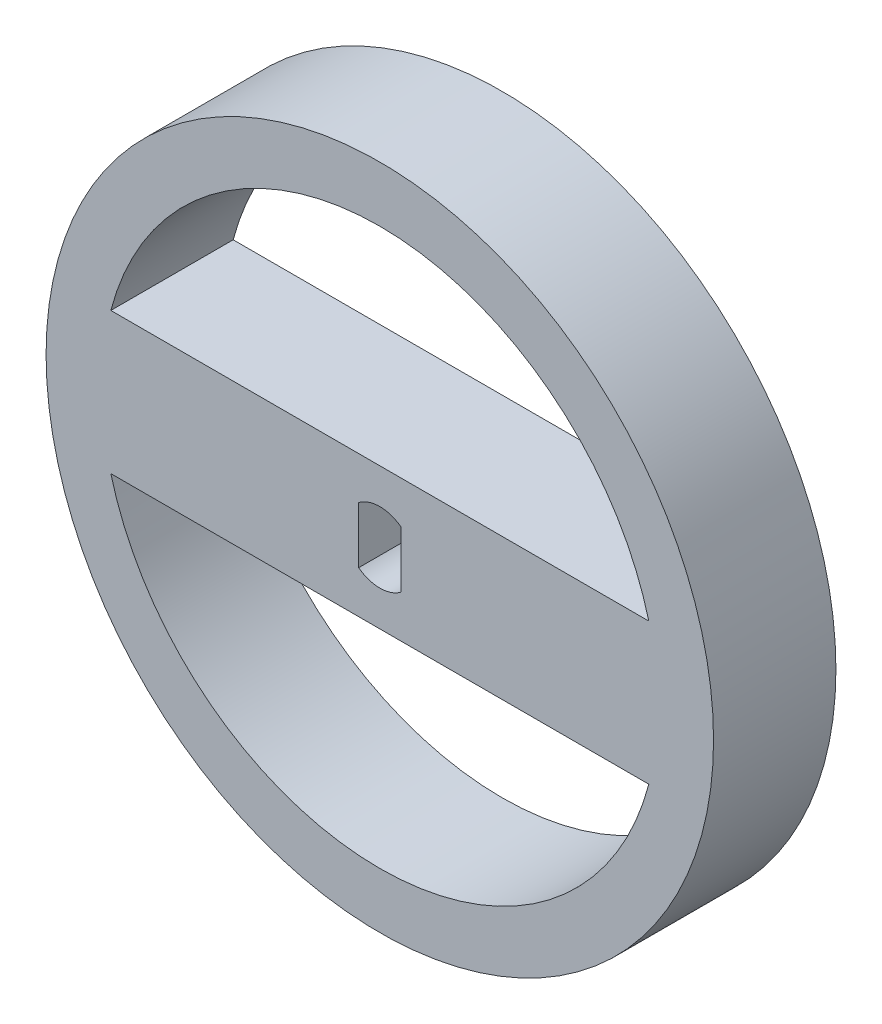
from build123d import *

# Parameters (mm, degrees)
SKETCH2_R           = 30
BOSS_EXTRUDE1_DEPTH = 11
CUT_EXTRUDE1_DEPTH  = 10


with BuildPart() as part:
    # Sketch2 → Boss-Extrude1 (new body)
    with BuildSketch(Plane.XY):
        with Locations((-124.832414552, 99.62481555)):
            Circle(SKETCH2_R)
        with BuildLine():
            Line((-100.652309094, 105.97481555), (-149.012520011, 105.97481555))
            ThreePointArc((-149.012520011, 105.97481555), (-124.832414552, 124.62481555), (-100.652309094, 105.97481555))
        make_face(mode=Mode.SUBTRACT)
        with BuildLine():
            Line((-149.012520011, 93.27481555), (-100.652309094, 93.27481555))
            ThreePointArc((-100.652309094, 93.27481555), (-124.832414552, 74.62481555), (-149.012520011, 93.27481555))
        make_face(mode=Mode.SUBTRACT)
    extrude(amount=-BOSS_EXTRUDE1_DEPTH)

    # Sketch2<3> → Cut-Extrude1 (cut)
    with BuildSketch(Plane.XY):
        with BuildLine():
            ThreePointArc((-122.927414552, 102.16481555), (-124.832414552, 102.79981555), (-126.737414552, 102.16481555))
            Line((-126.737414552, 102.16481555), (-126.737414552, 97.08481555))
            ThreePointArc((-126.737414552, 97.08481555), (-124.832414552, 96.44981555), (-122.927414552, 97.08481555))
            Line((-122.927414552, 97.08481555), (-122.927414552, 102.16481555))
        make_face()
    extrude(amount=-CUT_EXTRUDE1_DEPTH, mode=Mode.SUBTRACT)


solid = part.part
